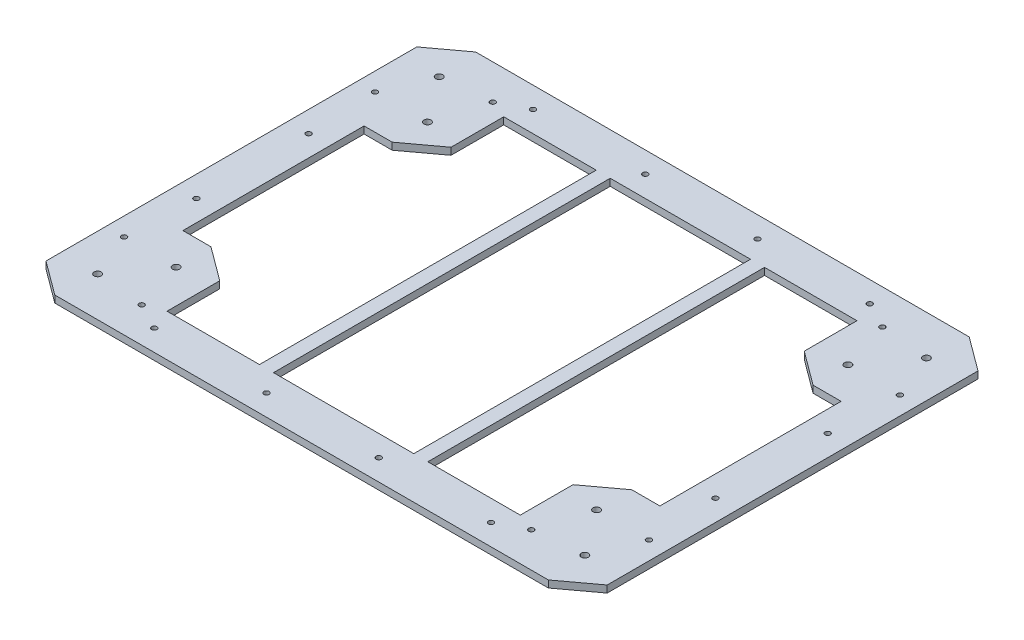
from build123d import *

# Parameters (mm, degrees)
SKETCH1_W           = 63.5
SKETCH1_H           = 152.4
BOSS_EXTRUDE1_DEPTH = 3.175
SKETCH2_R           = 1.5875
SKETCH2_R_2         = 1.190625
CUT_EXTRUDE1_DEPTH  = 159.781746826
SKETCH3_R           = 1.190625
CUT_EXTRUDE2_DEPTH  = 159.781746826


with BuildPart() as part:
    # Sketch1 → Boss-Extrude1 (new body)
    with BuildSketch(Plane(origin=(0, 0, 0), x_dir=(1, 0, 0), z_dir=(0, 1, 0))):
        Polygon((-111.686526805, 95.25), (-127, 83.918625912), (-127, -83.918625912), (-111.686526805, -95.25), (111.686526805, -95.25), (127, -83.918625912), (127, 83.918625912), (111.686526805, 95.25), align=None)
        Polygon((-107.95, -41.010963508), (-107.95, 41.010963508), (-95.25, 41.010963508), (-79.936526805, 52.342337595), (-79.936526805, 76.2), (-38.1, 76.2), (-38.1, -76.2), (-79.936526805, -76.2), (-79.936526805, -52.342337595), (-95.25, -41.010963508), align=None, mode=Mode.SUBTRACT)
        Rectangle(SKETCH1_W, SKETCH1_H, mode=Mode.SUBTRACT)
        Polygon((79.936526805, -76.2), (38.1, -76.2), (38.1, 76.2), (79.936526805, 76.2), (79.936526805, 52.342337595), (95.25, 41.010963508), (107.95, 41.010963508), (107.95, -41.010963508), (95.25, -41.010963508), (79.936526805, -52.342337595), align=None, mode=Mode.SUBTRACT)
    extrude(amount=BOSS_EXTRUDE1_DEPTH)

    # Sketch2 → Cut-Extrude1 (cut, through all)
    with BuildSketch(Plane(origin=(0, 3.175, 0), x_dir=(1, 0, 0), z_dir=(0, 1, 0))):
        with Locations(Location((-95.147512794, 56.885632681, 0), (0, 0, 270))):
            Circle(SKETCH2_R)
        with Locations(Location((-110.256011578, 77.303596941, 0), (0, 0, 270))):
            Circle(SKETCH2_R)
        with Locations(Location((110.256011578, 77.303596941, 0), (0, 0, 90))):
            Circle(SKETCH2_R)
        with Locations(Location((95.147512794, 56.885632681, 0), (0, 0, 90))):
            Circle(SKETCH2_R)
        with Locations(Location((110.256011578, -77.303596941, 0), (0, 0, 270))):
            Circle(SKETCH2_R)
        with Locations(Location((95.147512794, -56.885632681, 0), (0, 0, 270))):
            Circle(SKETCH2_R)
        with Locations(Location((-110.256011578, -77.303596941, 0), (0, 0, 90))):
            Circle(SKETCH2_R)
        with Locations(Location((-95.147512794, -56.885632681, 0), (0, 0, 90))):
            Circle(SKETCH2_R)
        with Locations(Location((-88.154790208, 79.461855841, 0), (0, 0, 270))):
            Circle(SKETCH2_R_2)
        with Locations(Location((-118.781736597, 56.799107666, 0), (0, 0, 90))):
            Circle(SKETCH2_R_2)
        with Locations(Location((118.781736597, 56.799107666, 0), (0, 0, 270))):
            Circle(SKETCH2_R_2)
        with Locations(Location((88.154790208, 79.461855841, 0), (0, 0, 90))):
            Circle(SKETCH2_R_2)
        with Locations(Location((118.781736597, -56.799107666, 0), (0, 0, 90))):
            Circle(SKETCH2_R_2)
        with Locations(Location((88.154790208, -79.461855841, 0), (0, 0, 270))):
            Circle(SKETCH2_R_2)
        with Locations(Location((-88.154790208, -79.461855841, 0), (0, 0, 90))):
            Circle(SKETCH2_R_2)
        with Locations(Location((-118.781736597, -56.799107666, 0), (0, 0, 270))):
            Circle(SKETCH2_R_2)
    extrude(amount=-CUT_EXTRUDE1_DEPTH, mode=Mode.SUBTRACT)

    # Sketch3 → Cut-Extrude2 (cut, through all)
    with BuildSketch(Plane(origin=(0, 3.175, 0), x_dir=(1, 0, 0), z_dir=(0, 1, 0))):
        with Locations(Location((-76.2, 85.725, 0), (0, 0, 270))):
            Circle(SKETCH3_R)
        with Locations(Location((-25.4, 85.725, 0), (0, 0, 270))):
            Circle(SKETCH3_R)
        with Locations(Location((25.4, 85.725, 0), (0, 0, 270))):
            Circle(SKETCH3_R)
        with Locations(Location((76.2, 85.725, 0), (0, 0, 270))):
            Circle(SKETCH3_R)
        with Locations(Location((76.2, -85.725, 0), (0, 0, 90))):
            Circle(SKETCH3_R)
        with Locations(Location((25.4, -85.725, 0), (0, 0, 90))):
            Circle(SKETCH3_R)
        with Locations(Location((-25.4, -85.725, 0), (0, 0, 90))):
            Circle(SKETCH3_R)
        with Locations(Location((-76.2, -85.725, 0), (0, 0, 90))):
            Circle(SKETCH3_R)
        with Locations(Location((-117.475, -25.4, 0), (0, 0, 270))):
            Circle(SKETCH3_R)
        with Locations(Location((-117.475, 25.4, 0), (0, 0, 270))):
            Circle(SKETCH3_R)
        with Locations(Location((117.475, 25.4, 0), (0, 0, 90))):
            Circle(SKETCH3_R)
        with Locations(Location((117.475, -25.4, 0), (0, 0, 90))):
            Circle(SKETCH3_R)
    extrude(amount=-CUT_EXTRUDE2_DEPTH, mode=Mode.SUBTRACT)


solid = part.part
